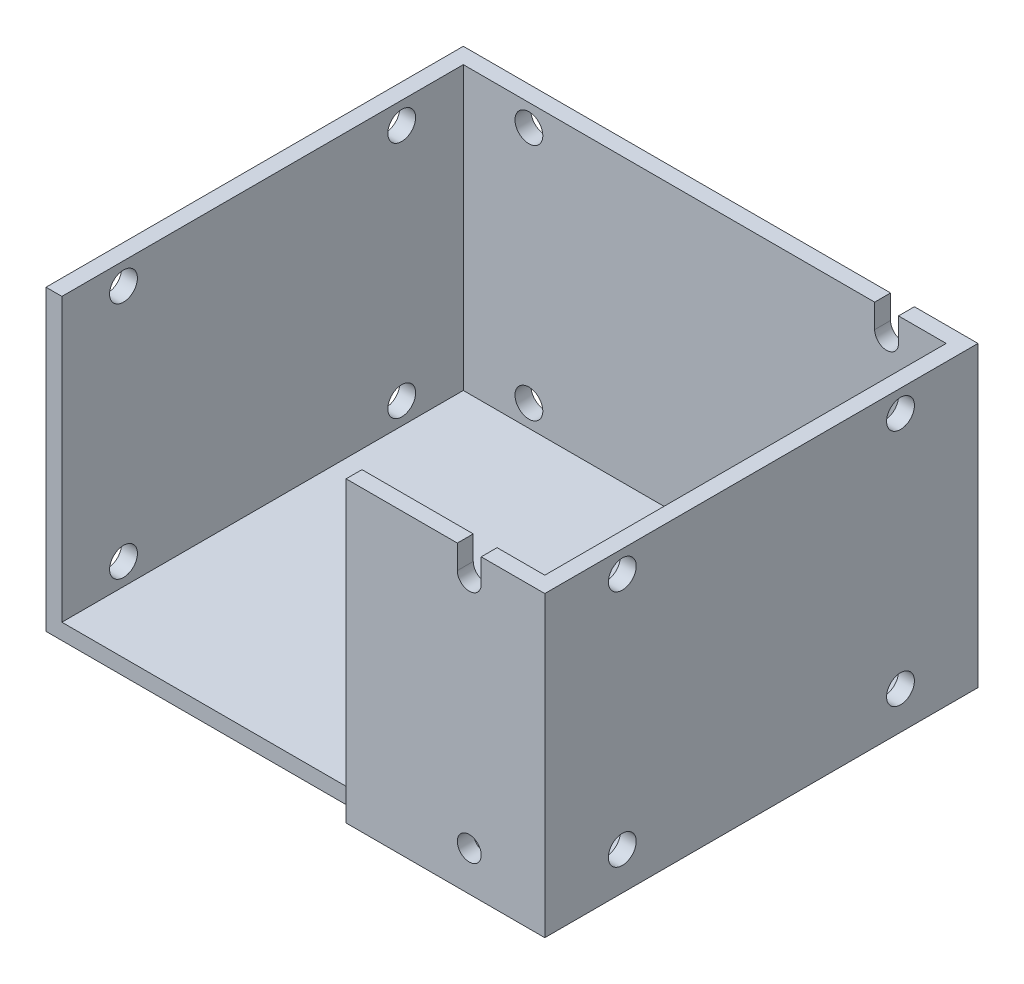
from build123d import *

# Parameters (mm, degrees)
CROQUIS1_W              = 121.5
CROQUIS1_H              = 101
SALIENTE_EXTRUIR2_DEPTH = 4
SALIENTE_EXTRUIR3_DEPTH = 75
CROQUIS3_W              = 50
CROQUIS3_H              = 4
SALIENTE_EXTRUIR4_DEPTH = 75
CORTAR_EXTRUIR1_REACH   = 161.266
CROQUIS4_R              = 3.5
CROQUIS5_R              = 3.5
CORTAR_EXTRUIR2_DEPTH   = 4
CORTAR_EXTRUIR3_START   = -54.5
CORTAR_EXTRUIR3_DEPTH   = 109


with BuildPart() as part:
    # Croquis1 → Saliente-Extruir2 (new body)
    with BuildSketch(Plane(origin=(0, 0, 0), x_dir=(1, 0, 0), z_dir=(0, 1, 0))):
        Rectangle(CROQUIS1_W, CROQUIS1_H)
    extrude(amount=SALIENTE_EXTRUIR2_DEPTH)

    # Croquis2 → Saliente-Extruir3 (add)
    with BuildSketch(Plane(origin=(0, 0, 0), x_dir=(1, 0, 0), z_dir=(0, 1, 0))):
        Polygon((60.75, -50.5), (64.75, -50.5), (64.75, 54.5), (60.75, 54.5), (-64.75, 54.5), (-64.75, -50.5), (-60.75, -50.5), (-60.75, 50.5), (60.75, 50.5), align=None)
    extrude(amount=SALIENTE_EXTRUIR3_DEPTH)

    # Croquis3 → Saliente-Extruir4 (add)
    with BuildSketch(Plane(origin=(0, 0, 0), x_dir=(1, 0, 0), z_dir=(0, 1, 0))):
        with Locations((39.75, -52.5)):
            Rectangle(CROQUIS3_W, CROQUIS3_H)
    extrude(amount=SALIENTE_EXTRUIR4_DEPTH)

    # Cortar-Extruir1: up to this face of the body (flat: up to its plane)
    cortar_extruir1_end = Plane(part.part.faces().sort_by_distance((-64.75, 37.5, -2))[0])
    # Croquis4 → Cortar-Extruir1 (cut, up to the picked face)
    with BuildSketch(Plane(origin=(64.75, 0, 0), x_dir=(0, 0, -1), z_dir=(1, 0, 0)), mode=Mode.PRIVATE) as cortar_extruir1_sk1:
        with Locations((-35, 69.5)):
            Circle(CROQUIS4_R)
    cortar_extruir1_tool1 = split(extrude(cortar_extruir1_sk1.sketch, amount=-CORTAR_EXTRUIR1_REACH, mode=Mode.PRIVATE), bisect_by=cortar_extruir1_end, keep=Keep.BOTH, mode=Mode.PRIVATE)
    # Croquis4 → Cortar-Extruir1 (cut, up to the picked face)
    with BuildSketch(Plane(origin=(64.75, 0, 0), x_dir=(0, 0, -1), z_dir=(1, 0, 0)), mode=Mode.PRIVATE) as cortar_extruir1_sk2:
        with Locations((35, 9.5)):
            Circle(CROQUIS4_R)
    cortar_extruir1_tool2 = split(extrude(cortar_extruir1_sk2.sketch, amount=-CORTAR_EXTRUIR1_REACH, mode=Mode.PRIVATE), bisect_by=cortar_extruir1_end, keep=Keep.BOTH, mode=Mode.PRIVATE)
    # Croquis4 → Cortar-Extruir1 (cut, up to the picked face)
    with BuildSketch(Plane(origin=(64.75, 0, 0), x_dir=(0, 0, -1), z_dir=(1, 0, 0)), mode=Mode.PRIVATE) as cortar_extruir1_sk3:
        with Locations((-35, 9.5)):
            Circle(CROQUIS4_R)
    cortar_extruir1_tool3 = split(extrude(cortar_extruir1_sk3.sketch, amount=-CORTAR_EXTRUIR1_REACH, mode=Mode.PRIVATE), bisect_by=cortar_extruir1_end, keep=Keep.BOTH, mode=Mode.PRIVATE)
    # Croquis4 → Cortar-Extruir1 (cut, up to the picked face)
    with BuildSketch(Plane(origin=(64.75, 0, 0), x_dir=(0, 0, -1), z_dir=(1, 0, 0)), mode=Mode.PRIVATE) as cortar_extruir1_sk4:
        with Locations((35, 69.5)):
            Circle(CROQUIS4_R)
    cortar_extruir1_tool4 = split(extrude(cortar_extruir1_sk4.sketch, amount=-CORTAR_EXTRUIR1_REACH, mode=Mode.PRIVATE), bisect_by=cortar_extruir1_end, keep=Keep.BOTH, mode=Mode.PRIVATE)
    add(cortar_extruir1_tool1.solids().sort_by(Axis((64.75, 69.5, 35), (-1, 0, 0)))[0], mode=Mode.SUBTRACT)
    add(cortar_extruir1_tool2.solids().sort_by(Axis((64.75, 9.5, -35), (-1, 0, 0)))[0], mode=Mode.SUBTRACT)
    add(cortar_extruir1_tool3.solids().sort_by(Axis((64.75, 9.5, 35), (-1, 0, 0)))[0], mode=Mode.SUBTRACT)
    add(cortar_extruir1_tool4.solids().sort_by(Axis((64.75, 69.5, -35), (-1, 0, 0)))[0], mode=Mode.SUBTRACT)

    # Croquis5 → Cortar-Extruir2 (cut)
    with BuildSketch(Plane(origin=(0, 0, -54.5), x_dir=(-1, 0, 0), z_dir=(0, 0, -1))):
        with Locations((44.25, 69.5)):
            Circle(CROQUIS5_R)
        with Locations((44.25, 9.5)):
            Circle(CROQUIS5_R)
    extrude(amount=-CORTAR_EXTRUIR2_DEPTH, mode=Mode.SUBTRACT)

    # Croquis6 → Cortar-Extruir3 (cut)
    with BuildSketch(Plane.XY.offset(CORTAR_EXTRUIR3_START)):
        with BuildLine():
            Line((42.75, 69), (42.75, 75))
            Line((42.75, 75), (45.75, 75))
            Line((45.75, 75), (48.75, 75))
            Line((48.75, 75), (48.75, 69))
            ThreePointArc((48.75, 69), (45.75, 66), (42.75, 69))
        make_face()
        with BuildLine():
            ThreePointArc((48.75, 10), (47.871320344, 12.121320344), (45.75, 13))
            Line((45.75, 13), (45.75, 7))
            ThreePointArc((45.75, 7), (47.871320344, 7.878679656), (48.75, 10))
        make_face()
        with BuildLine():
            Line((45.75, 7), (45.75, 13))
            ThreePointArc((45.75, 13), (42.75, 10), (45.75, 7))
        make_face()
    extrude(amount=CORTAR_EXTRUIR3_DEPTH, mode=Mode.SUBTRACT)


solid = part.part
